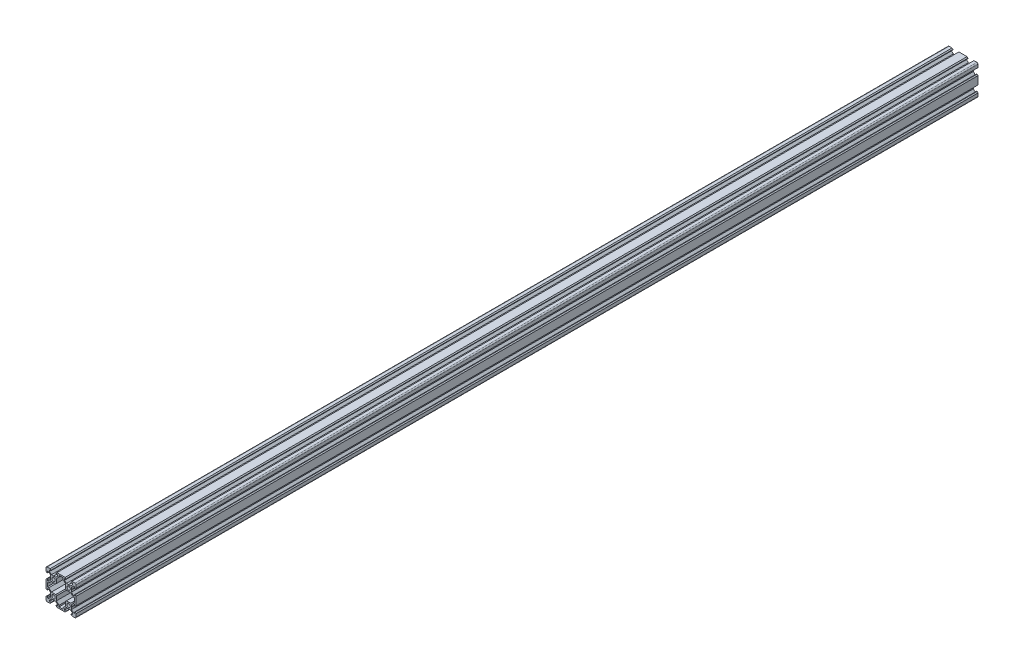
from build123d import *

# Parameters (mm, degrees)
SKETCH1_R           = 2.3
BOSS_EXTRUDE1_DEPTH = 1200


with BuildPart() as part:
    # Sketch1 → Boss-Extrude1 (new body)
    with BuildSketch(Plane.XY):
        with BuildLine():
            Line((14.58, -20), (18.5, -20))
            ThreePointArc((18.5, -20), (19.560660172, -19.560660172), (20, -18.5))
            Line((20, -18.5), (20, -14.58))
            Line((20, -14.58), (18.815, -13.395))
            Line((18.815, -13.395), (18.2, -13.395))
            Line((18.2, -13.395), (18.2, -15.5))
            Line((18.2, -15.5), (16.560660172, -15.5))
            Line((16.560660172, -15.5), (13.9, -12.839339828))
            Line((13.9, -12.839339828), (13.9, -10.21))
            Line((13.9, -10.21), (13.69, -10))
            Line((13.69, -10), (13.9, -9.79))
            Line((13.9, -9.79), (13.9, -7.160660172))
            Line((13.9, -7.160660172), (16.560660172, -4.5))
            Line((16.560660172, -4.5), (18.2, -4.5))
            Line((18.2, -4.5), (18.2, -6.605))
            Line((18.2, -6.605), (18.815, -6.605))
            Line((18.815, -6.605), (20, -5.42))
            Line((20, -5.42), (20, 5.42))
            Line((20, 5.42), (18.815, 6.605))
            Line((18.815, 6.605), (18.2, 6.605))
            Line((18.2, 6.605), (18.2, 4.5))
            Line((18.2, 4.5), (16.560660172, 4.5))
            Line((16.560660172, 4.5), (13.9, 7.160660172))
            Line((13.9, 7.160660172), (13.9, 9.79))
            Line((13.9, 9.79), (13.69, 10))
            Line((13.69, 10), (13.9, 10.21))
            Line((13.9, 10.21), (13.9, 12.839339828))
            Line((13.9, 12.839339828), (16.560660172, 15.5))
            Line((16.560660172, 15.5), (18.2, 15.5))
            Line((18.2, 15.5), (18.2, 13.395))
            Line((18.2, 13.395), (18.815, 13.395))
            Line((18.815, 13.395), (20, 14.58))
            Line((20, 14.58), (20, 18.5))
            ThreePointArc((20, 18.5), (19.560660172, 19.560660172), (18.5, 20))
            Line((18.5, 20), (14.58, 20))
            Line((14.58, 20), (13.395, 18.815))
            Line((13.395, 18.815), (13.395, 18.2))
            Line((13.395, 18.2), (15.5, 18.2))
            Line((15.5, 18.2), (15.5, 16.560660172))
            Line((15.5, 16.560660172), (12.839339828, 13.9))
            Line((12.839339828, 13.9), (10.21, 13.9))
            Line((10.21, 13.9), (10, 13.69))
            Line((10, 13.69), (9.79, 13.9))
            Line((9.79, 13.9), (7.160660172, 13.9))
            Line((7.160660172, 13.9), (4.5, 16.560660172))
            Line((4.5, 16.560660172), (4.5, 18.2))
            Line((4.5, 18.2), (6.605, 18.2))
            Line((6.605, 18.2), (6.605, 18.815))
            Line((6.605, 18.815), (5.42, 20))
            Line((5.42, 20), (-5.42, 20))
            Line((-5.42, 20), (-6.605, 18.815))
            Line((-6.605, 18.815), (-6.605, 18.2))
            Line((-6.605, 18.2), (-4.5, 18.2))
            Line((-4.5, 18.2), (-4.5, 16.560660172))
            Line((-4.5, 16.560660172), (-7.160660172, 13.9))
            Line((-7.160660172, 13.9), (-9.79, 13.9))
            Line((-9.79, 13.9), (-10, 13.69))
            Line((-10, 13.69), (-10.21, 13.9))
            Line((-10.21, 13.9), (-12.839339828, 13.9))
            Line((-12.839339828, 13.9), (-15.5, 16.560660172))
            Line((-15.5, 16.560660172), (-15.5, 18.2))
            Line((-15.5, 18.2), (-13.395, 18.2))
            Line((-13.395, 18.2), (-13.395, 18.815))
            Line((-13.395, 18.815), (-14.58, 20))
            Line((-14.58, 20), (-18.5, 20))
            ThreePointArc((-18.5, 20), (-19.560660172, 19.560660172), (-20, 18.5))
            Line((-20, 18.5), (-20, 14.58))
            Line((-20, 14.58), (-18.815, 13.395))
            Line((-18.815, 13.395), (-18.2, 13.395))
            Line((-18.2, 13.395), (-18.2, 15.5))
            Line((-18.2, 15.5), (-16.560660172, 15.5))
            Line((-16.560660172, 15.5), (-13.9, 12.839339828))
            Line((-13.9, 12.839339828), (-13.9, 10.21))
            Line((-13.9, 10.21), (-13.69, 10))
            Line((-13.69, 10), (-13.9, 9.79))
            Line((-13.9, 9.79), (-13.9, 7.160660172))
            Line((-13.9, 7.160660172), (-16.560660172, 4.5))
            Line((-16.560660172, 4.5), (-18.2, 4.5))
            Line((-18.2, 4.5), (-18.2, 6.605))
            Line((-18.2, 6.605), (-18.815, 6.605))
            Line((-18.815, 6.605), (-20, 5.42))
            Line((-20, 5.42), (-20, -5.42))
            Line((-20, -5.42), (-18.815, -6.605))
            Line((-18.815, -6.605), (-18.2, -6.605))
            Line((-18.2, -6.605), (-18.2, -4.5))
            Line((-18.2, -4.5), (-16.560660172, -4.5))
            Line((-16.560660172, -4.5), (-13.9, -7.160660172))
            Line((-13.9, -7.160660172), (-13.9, -9.79))
            Line((-13.9, -9.79), (-13.69, -10))
            Line((-13.69, -10), (-13.9, -10.21))
            Line((-13.9, -10.21), (-13.9, -12.839339828))
            Line((-13.9, -12.839339828), (-16.560660172, -15.5))
            Line((-16.560660172, -15.5), (-18.2, -15.5))
            Line((-18.2, -15.5), (-18.2, -13.395))
            Line((-18.2, -13.395), (-18.815, -13.395))
            Line((-18.815, -13.395), (-20, -14.58))
            Line((-20, -14.58), (-20, -18.5))
            ThreePointArc((-20, -18.5), (-19.560660172, -19.560660172), (-18.5, -20))
            Line((-18.5, -20), (-14.58, -20))
            Line((-14.58, -20), (-13.395, -18.815))
            Line((-13.395, -18.815), (-13.395, -18.2))
            Line((-13.395, -18.2), (-15.5, -18.2))
            Line((-15.5, -18.2), (-15.5, -16.560660172))
            Line((-15.5, -16.560660172), (-12.839339828, -13.9))
            Line((-12.839339828, -13.9), (-10.21, -13.9))
            Line((-10.21, -13.9), (-10, -13.69))
            Line((-10, -13.69), (-9.79, -13.9))
            Line((-9.79, -13.9), (-7.160660172, -13.9))
            Line((-7.160660172, -13.9), (-4.5, -16.560660172))
            Line((-4.5, -16.560660172), (-4.5, -18.2))
            Line((-4.5, -18.2), (-6.605, -18.2))
            Line((-6.605, -18.2), (-6.605, -18.815))
            Line((-6.605, -18.815), (-5.42, -20))
            Line((-5.42, -20), (5.42, -20))
            Line((5.42, -20), (6.605, -18.815))
            Line((6.605, -18.815), (6.605, -18.2))
            Line((6.605, -18.2), (4.5, -18.2))
            Line((4.5, -18.2), (4.5, -16.560660172))
            Line((4.5, -16.560660172), (7.160660172, -13.9))
            Line((7.160660172, -13.9), (9.79, -13.9))
            Line((9.79, -13.9), (10, -13.69))
            Line((10, -13.69), (10.21, -13.9))
            Line((10.21, -13.9), (12.839339828, -13.9))
            Line((12.839339828, -13.9), (15.5, -16.560660172))
            Line((15.5, -16.560660172), (15.5, -18.2))
            Line((15.5, -18.2), (13.395, -18.2))
            Line((13.395, -18.2), (13.395, -18.815))
            Line((13.395, -18.815), (14.58, -20))
        make_face()
        with Locations((-10, -10)):
            Circle(SKETCH1_R, mode=Mode.SUBTRACT)
        with Locations((10, -10)):
            Circle(SKETCH1_R, mode=Mode.SUBTRACT)
        Polygon((-16.239339828, -2.7), (-18.2, -2.7), (-18.2, 2.7), (-16.239339828, 2.7), (-12.839339828, 6.1), (-7.160660172, 6.1), (-6.1, 7.160660172), (-6.1, 12.839339828), (-2.7, 16.239339828), (-2.7, 18.2), (2.7, 18.2), (2.7, 16.239339828), (6.1, 12.839339828), (6.1, 7.160660172), (7.160660172, 6.1), (12.839339828, 6.1), (16.239339828, 2.7), (18.2, 2.7), (18.2, -2.7), (16.239339828, -2.7), (12.839339828, -6.1), (7.160660172, -6.1), (6.1, -7.160660172), (6.1, -12.839339828), (2.7, -16.239339828), (2.7, -18.2), (-2.7, -18.2), (-2.7, -16.239339828), (-6.1, -12.839339828), (-6.1, -7.160660172), (-7.160660172, -6.1), (-12.839339828, -6.1), align=None, mode=Mode.SUBTRACT)
        with Locations((-10, 10)):
            Circle(SKETCH1_R, mode=Mode.SUBTRACT)
        with Locations((10, 10)):
            Circle(SKETCH1_R, mode=Mode.SUBTRACT)
    extrude(amount=BOSS_EXTRUDE1_DEPTH)


solid = part.part
